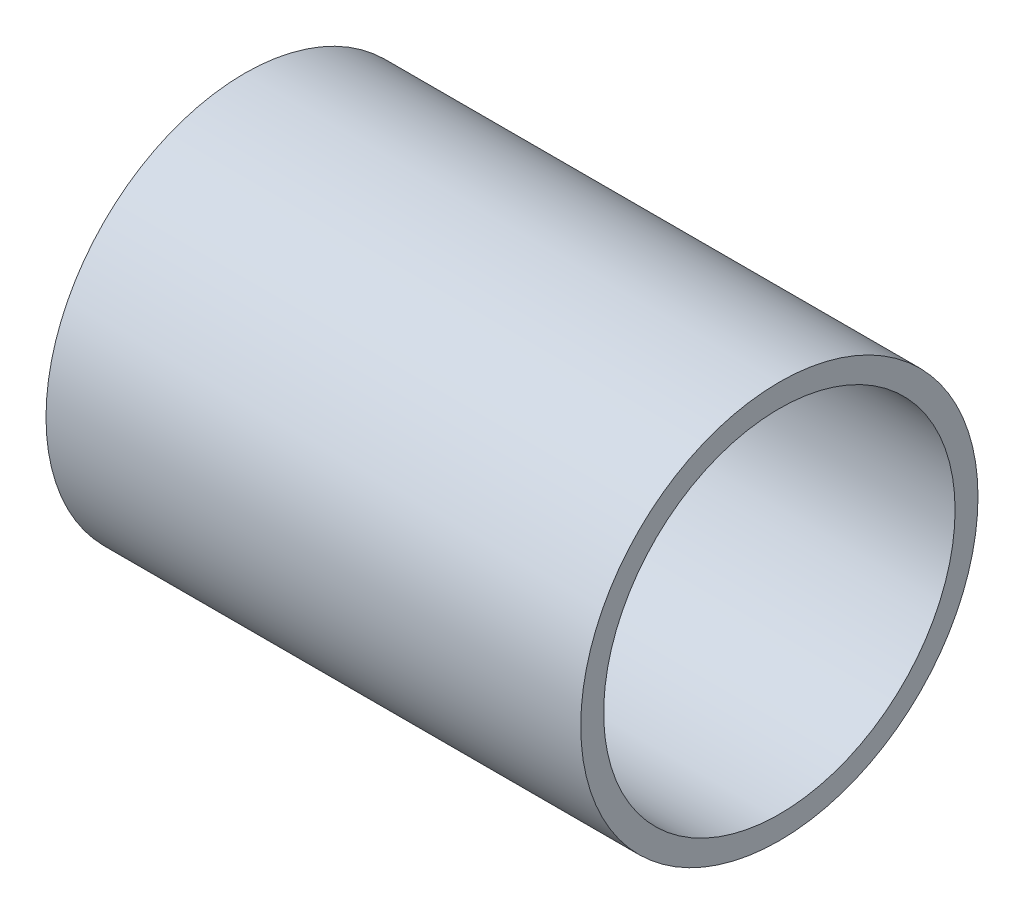
from build123d import *

# Parameters (mm, degrees)
SKETCH1_R           = 26
SKETCH1_R_2         = 23
BOSS_EXTRUDE1_DEPTH = 70


with BuildPart() as part:
    # Sketch1 → Boss-Extrude1 (new body)
    with BuildSketch(Plane(origin=(0, 0, 0), x_dir=(0, 0, -1), z_dir=(1, 0, 0))):
        Circle(SKETCH1_R)
        Circle(SKETCH1_R_2, mode=Mode.SUBTRACT)
    extrude(amount=-BOSS_EXTRUDE1_DEPTH)


solid = part.part
